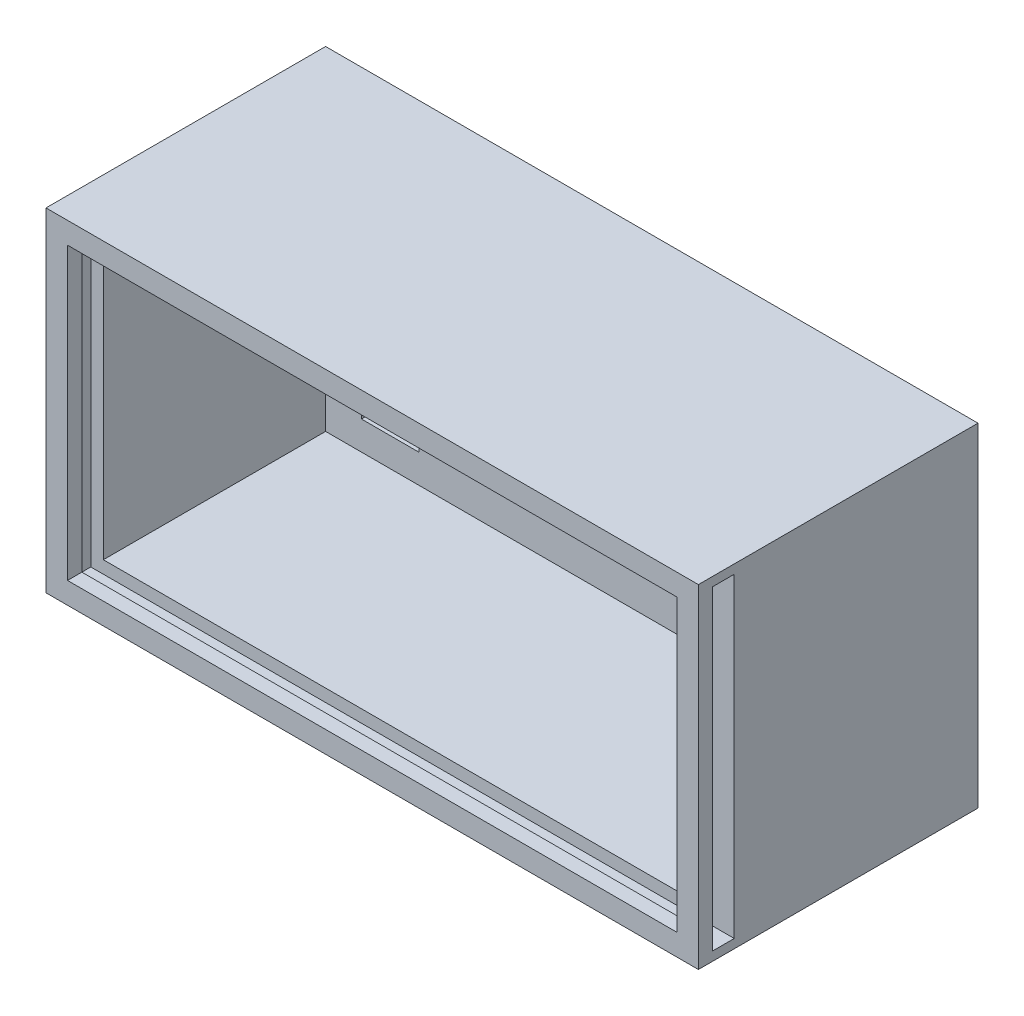
from build123d import *

# Parameters (mm, degrees)
SKETCH_1_W          = 91
SKETCH_1_H          = 46.5
SKETCH_1_W_2        = 85
SKETCH_1_H_2        = 40.5
EXTRUDE_1_DEPTH     = 36
SKETCH_2_W          = 91
SKETCH_2_H          = 46.5
EXTRUDE_2_DEPTH     = 3
SKETCH_3_W          = 90
SKETCH_3_H          = 44
CUT_EXTRUDE_1_DEPTH = 3
SKETCH_4_W          = 8
SKETCH_4_H          = 12
SKETCH_4_W_2        = 5
SKETCH_4_H_2        = 8
CUT_EXTRUDE_2_DEPTH = 10


with BuildPart() as part:
    # 草圖1 → 填料-伸長1 (new body)
    with BuildSketch(Plane.XY):
        Rectangle(SKETCH_1_W, SKETCH_1_H)
        Rectangle(SKETCH_1_W_2, SKETCH_1_H_2, mode=Mode.SUBTRACT)
    extrude(amount=EXTRUDE_1_DEPTH)

    # 草圖2 → 填料-伸長2 (add)
    with BuildSketch(Plane(origin=(0, 0, 0), x_dir=(-1, 0, 0), z_dir=(0, 0, -1))):
        Rectangle(SKETCH_2_W, SKETCH_2_H)
    extrude(amount=EXTRUDE_2_DEPTH)

    # 草圖3 → 除料-伸長1 (cut)
    with BuildSketch(Plane.XY.offset(31)):
        with Locations((0.75, 0)):
            Rectangle(SKETCH_3_W, SKETCH_3_H)
    extrude(amount=CUT_EXTRUDE_1_DEPTH, mode=Mode.SUBTRACT)

    # 草圖4 → 除料-伸長2 (cut)
    with BuildSketch(Plane(origin=(0, 0, -3), x_dir=(-1, 0, 0), z_dir=(0, 0, -1))):
        with Locations((33.5, -10.25)):
            Rectangle(SKETCH_4_W, SKETCH_4_H)
        with Locations((-37.648642632, 13.25)):
            Rectangle(SKETCH_4_W_2, SKETCH_4_H_2)
    extrude(amount=-CUT_EXTRUDE_2_DEPTH, mode=Mode.SUBTRACT)


solid = part.part
